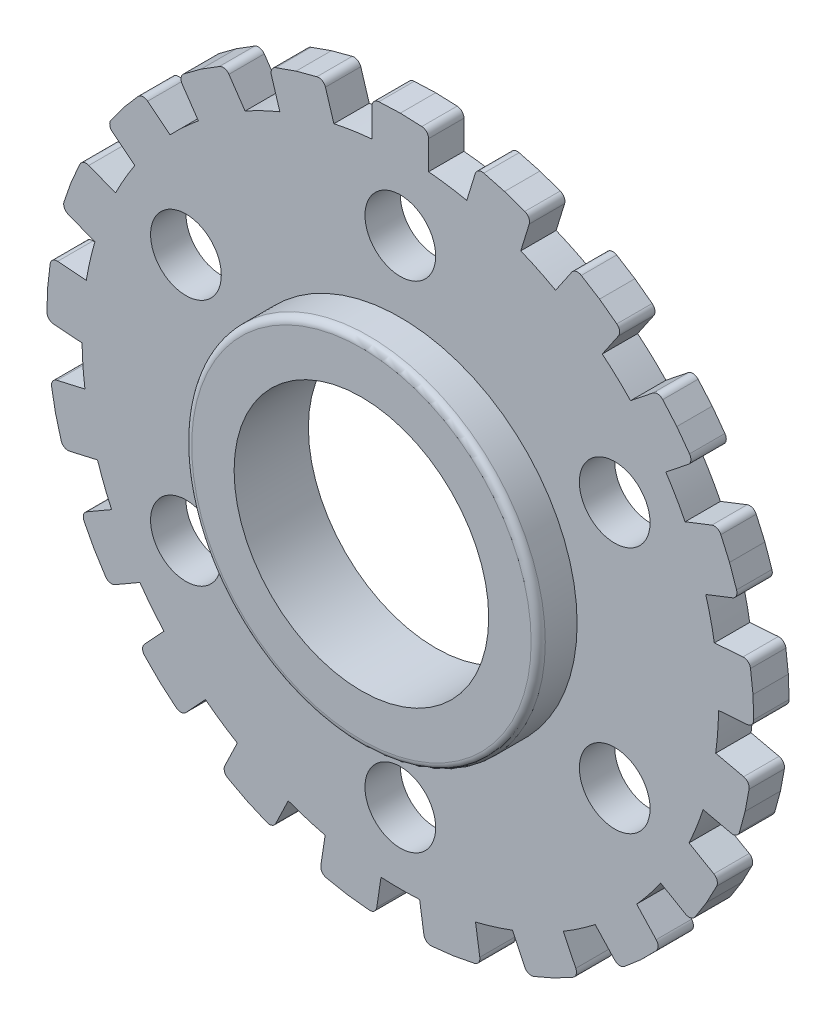
from build123d import *

# Parameters (mm, degrees)
SKETCH1_R               = 5
SKETCH1_R_2             = 18
BOSS_EXTRUDE4_DEPTH     = 2.5
SKETCH1_9_R             = 25
BOSS_EXTRUDE6_DEPTH     = 8
CUT_EXTRUDE5_DEPTH      = 72.13825771
CUT_EXTRUDE5_DEPTH_BACK = 72.13825771
SKETCH1_10_R            = 18
FILLET1_R               = 1


with BuildPart() as part:
    # Sketch1 → Boss-Extrude4 (new, symmetric)
    with BuildSketch(Plane.XY):
        with BuildLine():
            Line((3.036798719, 49.878430757), (0, 50))
            Line((0, 50), (-3.036798719, 49.878430757))
            ThreePointArc((-3.036798719, 49.878430757), (-3.717908974, 49.5720514), (-3.996798719, 48.879231077))
            Line((-3.996798719, 48.879231077), (-3.996798719, 44.822155236))
            ThreePointArc((-3.996798719, 44.822155236), (-6.706901978, 44.49738718), (-9.392330018, 44.008909744))
            Line((-9.392330018, 44.008909744), (-10.588174115, 47.885741089))
            ThreePointArc((-10.588174115, 47.885741089), (-11.058885946, 48.465577153), (-11.800043285, 48.557584163))
            Line((-11.800043285, 48.557584163), (-14.737758721, 47.778640289))
            Line((-14.737758721, 47.778640289), (-17.60380783, 46.767359891))
            ThreePointArc((-17.60380783, 46.767359891), (-18.164351366, 46.273831337), (-18.226638447, 45.529586882))
            Line((-18.226638447, 45.529586882), (-17.03079435, 41.652755537))
            ThreePointArc((-17.03079435, 41.652755537), (-19.52476826, 40.543599056), (-21.946909015, 39.285279491))
            Line((-21.946909015, 39.285279491), (-24.232341214, 42.637392861))
            ThreePointArc((-24.232341214, 42.637392861), (-24.853050319, 43.052723688), (-25.588399659, 42.922183124))
            Line((-25.588399659, 42.922183124), (-28.166002903, 41.311938716))
            Line((-28.166002903, 41.311938716), (-30.606641361, 39.500803863))
            ThreePointArc((-30.606641361, 39.500803863), (-30.996811427, 38.86397829), (-30.836961363, 38.134439088))
            Line((-30.836961363, 38.134439088), (-28.551529165, 34.782325718))
            ThreePointArc((-28.551529165, 34.782325718), (-30.6077732, 32.987334232), (-32.551408834, 31.070979755))
            Line((-32.551408834, 31.070979755), (-35.723358454, 33.600525167))
            ThreePointArc((-35.723358454, 33.600525167), (-36.438912106, 33.81444679), (-37.10311443, 33.472957754))
            Line((-37.10311443, 33.472957754), (-39.091574123, 31.174490093))
            Line((-39.091574123, 31.174490093), (-40.889940493, 28.724428065))
            ThreePointArc((-40.889940493, 28.724428065), (-41.075068765, 28.00089022), (-40.707284936, 27.350879032))
            Line((-40.707284936, 27.350879032), (-37.535335317, 24.821333619))
            ThreePointArc((-37.535335317, 24.821333619), (-38.97114317, 22.5), (-40.263573129, 20.095887114))
            Line((-40.263573129, 20.095887114), (-44.040198525, 21.578103358))
            ThreePointArc((-44.040198525, 21.578103358), (-44.787016642, 21.571607902), (-45.32105466, 21.049513194))
            Line((-45.32105466, 21.049513194), (-46.543687432, 18.267051218))
            Line((-46.543687432, 18.267051218), (-47.53998897, 15.395760779))
            ThreePointArc((-47.53998897, 15.395760779), (-47.503625988, 14.649800175), (-46.960587602, 14.137073346))
            Line((-46.960587602, 14.137073346), (-43.183962205, 12.654857102))
            ThreePointArc((-43.183962205, 12.654857102), (-43.871756048, 10.013442028), (-44.398142257, 7.335186715))
            Line((-44.398142257, 7.335186715), (-48.443873691, 7.638372372))
            ThreePointArc((-48.443873691, 7.638372372), (-49.155598205, 7.412036987), (-49.512020296, 6.755727012))
            Line((-49.512020296, 6.755727012), (-49.860189859, 3.736504679))
            Line((-49.860189859, 3.736504679), (-49.965900801, 0.699112585))
            ThreePointArc((-49.965900801, 0.699112585), (-49.711277576, -0.002988906), (-49.041235976, -0.332873346))
            Line((-49.041235976, -0.332873346), (-44.995504541, -0.636059004))
            ThreePointArc((-44.995504541, -0.636059004), (-44.874170873, -3.362854211), (-44.587741607, -6.077277215))
            Line((-44.587741607, -6.077277215), (-48.543098087, -6.98006152))
            ThreePointArc((-48.543098087, -6.98006152), (-49.156489151, -7.406125942), (-49.303625648, -8.138335162))
            Line((-49.303625648, -8.138335162), (-48.746395609, -11.126046698))
            Line((-48.746395609, -11.126046698), (-47.952123074, -14.059654831))
            ThreePointArc((-47.952123074, -14.059654831), (-47.501863997, -14.655512409), (-46.764355319, -14.773242781))
            Line((-46.764355319, -14.773242781), (-42.80899884, -13.870458476))
            ThreePointArc((-42.80899884, -13.870458476), (-41.889318689, -16.440346096), (-40.815524446, -18.949748394))
            Line((-40.815524446, -18.949748394), (-44.32905519, -20.978286314))
            ThreePointArc((-44.32905519, -20.978286314), (-44.789610317, -21.56622208), (-44.714387496, -22.309270542))
            Line((-44.714387496, -22.309270542), (-43.301270189, -25))
            Line((-43.301270189, -25), (-41.677588777, -27.569160215))
            ThreePointArc((-41.677588777, -27.569160215), (-41.071701343, -28.005829321), (-40.332256471, -27.900944763))
            Line((-40.332256471, -27.900944763), (-36.818725727, -25.872406842))
            ThreePointArc((-36.818725727, -25.872406842), (-35.182416711, -28.057041084), (-33.416668822, -30.138451268))
            Line((-33.416668822, -30.138451268), (-36.176181204, -33.112498308))
            ThreePointArc((-36.176181204, -33.112498308), (-36.44297805, -33.810064744), (-36.152079789, -34.497929332))
            Line((-36.152079789, -34.497929332), (-34.008636889, -36.652593591))
            Line((-34.008636889, -36.652593591), (-31.699817818, -38.629024729))
            ThreePointArc((-31.699817818, -38.629024729), (-30.992137785, -38.867705395), (-30.31645964, -38.549525362))
            Line((-30.31645964, -38.549525362), (-27.556947257, -35.575478322))
            ThreePointArc((-27.556947257, -35.575478322), (-25.349402613, -37.180744844), (-23.048595526, -38.649220487))
            Line((-23.048595526, -38.649220487), (-24.808894762, -42.304519515))
            ThreePointArc((-24.808894762, -42.304519515), (-24.858227257, -43.049734782), (-24.377501142, -43.621295709))
            Line((-24.377501142, -43.621295709), (-21.694186956, -45.048443395))
            Line((-21.694186956, -45.048443395), (-18.905378934, -46.256530875))
            ThreePointArc((-18.905378934, -46.256530875), (-18.158786778, -46.276015277), (-17.606912328, -45.77281146))
            Line((-17.606912328, -45.77281146), (-15.846613092, -42.117512433))
            ThreePointArc((-15.846613092, -42.117512433), (-13.263982848, -43.00077626), (-10.632553371, -43.725836857))
            Line((-10.632553371, -43.725836857), (-11.237229148, -47.737598513))
            ThreePointArc((-11.237229148, -47.737598513), (-11.064713882, -48.464246965), (-10.43687454, -48.868718533))
            Line((-10.43687454, -48.868718533), (-7.452113309, -49.441541311))
            Line((-7.452113309, -49.441541311), (-4.431114167, -49.773941259))
            ThreePointArc((-4.431114167, -49.773941259), (-3.711947877, -49.572498123), (-3.332913589, -48.92898239))
            Line((-3.332913589, -48.92898239), (-2.728237812, -44.917220734))
            ThreePointArc((-2.728237812, -44.917220734), (0, -45), (2.728237812, -44.917220734))
            Line((2.728237812, -44.917220734), (3.332913589, -48.92898239))
            ThreePointArc((3.332913589, -48.92898239), (3.711947877, -49.572498123), (4.431114167, -49.773941259))
            Line((4.431114167, -49.773941259), (7.452113309, -49.441541311))
            Line((7.452113309, -49.441541311), (10.43687454, -48.868718533))
            ThreePointArc((10.43687454, -48.868718533), (11.064713882, -48.464246965), (11.237229148, -47.737598513))
            Line((11.237229148, -47.737598513), (10.632553371, -43.725836857))
            ThreePointArc((10.632553371, -43.725836857), (13.263982848, -43.00077626), (15.846613092, -42.117512433))
            Line((15.846613092, -42.117512433), (17.606912328, -45.77281146))
            ThreePointArc((17.606912328, -45.77281146), (18.158786778, -46.276015277), (18.905378934, -46.256530875))
            Line((18.905378934, -46.256530875), (21.694186956, -45.048443395))
            Line((21.694186956, -45.048443395), (24.377501142, -43.621295709))
            ThreePointArc((24.377501142, -43.621295709), (24.858227257, -43.049734782), (24.808894762, -42.304519515))
            Line((24.808894762, -42.304519515), (23.048595526, -38.649220487))
            ThreePointArc((23.048595526, -38.649220487), (25.349402613, -37.180744844), (27.556947257, -35.575478322))
            Line((27.556947257, -35.575478322), (30.31645964, -38.549525362))
            ThreePointArc((30.31645964, -38.549525362), (30.992137785, -38.867705395), (31.699817818, -38.629024729))
            Line((31.699817818, -38.629024729), (34.008636889, -36.652593591))
            Line((34.008636889, -36.652593591), (36.152079789, -34.497929332))
            ThreePointArc((36.152079789, -34.497929332), (36.44297805, -33.810064744), (36.176181204, -33.112498308))
            Line((36.176181204, -33.112498308), (33.416668822, -30.138451268))
            ThreePointArc((33.416668822, -30.138451268), (35.182416711, -28.057041084), (36.818725727, -25.872406842))
            Line((36.818725727, -25.872406842), (40.332256471, -27.900944763))
            ThreePointArc((40.332256471, -27.900944763), (41.071701343, -28.005829321), (41.677588777, -27.569160215))
            Line((41.677588777, -27.569160215), (43.301270189, -25))
            Line((43.301270189, -25), (44.714387496, -22.309270542))
            ThreePointArc((44.714387496, -22.309270542), (44.789610317, -21.56622208), (44.32905519, -20.978286314))
            Line((44.32905519, -20.978286314), (40.815524446, -18.949748394))
            ThreePointArc((40.815524446, -18.949748394), (41.889318689, -16.440346096), (42.80899884, -13.870458475))
            Line((42.80899884, -13.870458475), (46.764355319, -14.773242781))
            ThreePointArc((46.764355319, -14.773242781), (47.501863997, -14.655512409), (47.952123074, -14.059654831))
            Line((47.952123074, -14.059654831), (48.746395609, -11.126046698))
            Line((48.746395609, -11.126046698), (49.303625648, -8.138335162))
            ThreePointArc((49.303625648, -8.138335162), (49.156489151, -7.406125942), (48.543098087, -6.98006152))
            Line((48.543098087, -6.98006152), (44.587741607, -6.077277215))
            ThreePointArc((44.587741607, -6.077277215), (44.874170873, -3.362854211), (44.995504542, -0.636059004))
            Line((44.995504542, -0.636059004), (49.041235976, -0.332873346))
            ThreePointArc((49.041235976, -0.332873346), (49.711277576, -0.002988906), (49.965900801, 0.699112585))
            Line((49.965900801, 0.699112585), (49.860189859, 3.736504679))
            Line((49.860189859, 3.736504679), (49.512020296, 6.755727012))
            ThreePointArc((49.512020296, 6.755727012), (49.155598205, 7.412036987), (48.443873691, 7.638372372))
            Line((48.443873691, 7.638372372), (44.398142257, 7.335186715))
            ThreePointArc((44.398142257, 7.335186715), (43.871756048, 10.013442028), (43.183962205, 12.654857102))
            Line((43.183962205, 12.654857102), (46.960587602, 14.137073346))
            ThreePointArc((46.960587602, 14.137073346), (47.503625988, 14.649800175), (47.53998897, 15.395760779))
            Line((47.53998897, 15.395760779), (46.543687432, 18.267051218))
            Line((46.543687432, 18.267051218), (45.32105466, 21.049513194))
            ThreePointArc((45.32105466, 21.049513194), (44.787016642, 21.571607902), (44.040198525, 21.578103358))
            Line((44.040198525, 21.578103358), (40.263573129, 20.095887114))
            ThreePointArc((40.263573129, 20.095887114), (38.97114317, 22.5), (37.535335317, 24.821333619))
            Line((37.535335317, 24.821333619), (40.707284936, 27.350879032))
            ThreePointArc((40.707284936, 27.350879032), (41.075068765, 28.00089022), (40.889940493, 28.724428065))
            Line((40.889940493, 28.724428065), (39.091574123, 31.174490093))
            Line((39.091574123, 31.174490093), (37.10311443, 33.472957754))
            ThreePointArc((37.10311443, 33.472957754), (36.438912106, 33.81444679), (35.723358454, 33.600525167))
            Line((35.723358454, 33.600525167), (32.551408834, 31.070979755))
            ThreePointArc((32.551408834, 31.070979755), (30.6077732, 32.987334232), (28.551529165, 34.782325718))
            Line((28.551529165, 34.782325718), (30.836961363, 38.134439088))
            ThreePointArc((30.836961363, 38.134439088), (30.996811427, 38.86397829), (30.606641361, 39.500803863))
            Line((30.606641361, 39.500803863), (28.166002903, 41.311938716))
            Line((28.166002903, 41.311938716), (25.588399659, 42.922183124))
            ThreePointArc((25.588399659, 42.922183124), (24.853050319, 43.052723688), (24.232341214, 42.637392861))
            Line((24.232341214, 42.637392861), (21.946909015, 39.285279491))
            ThreePointArc((21.946909015, 39.285279491), (19.52476826, 40.543599056), (17.03079435, 41.652755537))
            Line((17.03079435, 41.652755537), (18.226638447, 45.529586882))
            ThreePointArc((18.226638447, 45.529586882), (18.164351366, 46.273831337), (17.60380783, 46.767359891))
            Line((17.60380783, 46.767359891), (14.737758721, 47.778640289))
            Line((14.737758721, 47.778640289), (11.800043285, 48.557584163))
            ThreePointArc((11.800043285, 48.557584163), (11.058885946, 48.465577153), (10.588174115, 47.885741089))
            Line((10.588174115, 47.885741089), (9.392330018, 44.008909744))
            ThreePointArc((9.392330018, 44.008909744), (6.706901978, 44.49738718), (3.996798719, 44.822155236))
            Line((3.996798719, 44.822155236), (3.996798719, 48.879231077))
            ThreePointArc((3.996798719, 48.879231077), (3.717908974, 49.5720514), (3.036798719, 49.878430757))
        make_face()
        with Locations((0, -35)):
            Circle(SKETCH1_R, mode=Mode.SUBTRACT)
        with Locations((-30.310889132, -17.5)):
            Circle(SKETCH1_R, mode=Mode.SUBTRACT)
        with Locations((30.310889132, -17.5)):
            Circle(SKETCH1_R, mode=Mode.SUBTRACT)
        with Locations((-30.310889132, 17.5)):
            Circle(SKETCH1_R, mode=Mode.SUBTRACT)
        with Locations((0, 35)):
            Circle(SKETCH1_R, mode=Mode.SUBTRACT)
        with Locations((30.310889132, 17.5)):
            Circle(SKETCH1_R, mode=Mode.SUBTRACT)
        Circle(SKETCH1_R_2, mode=Mode.SUBTRACT)
    extrude(amount=BOSS_EXTRUDE4_DEPTH, both=True)

    # Sketch1<9> → Boss-Extrude6 (add)
    with BuildSketch(Plane.XY):
        Circle(SKETCH1_9_R)
    extrude(amount=BOSS_EXTRUDE6_DEPTH)

    # Sketch1<10> → Cut-Extrude5 (cut, two sides: drawn at the far end of the back side and taken through both)
    with BuildSketch(Plane.XY.offset(-CUT_EXTRUDE5_DEPTH_BACK)):
        Circle(SKETCH1_10_R)
    extrude(amount=CUT_EXTRUDE5_DEPTH + CUT_EXTRUDE5_DEPTH_BACK, mode=Mode.SUBTRACT)

    # Fillet1
    fillet1_edges = [part.edges().sort_by_distance(p)[0] for p in [
        (-25, 0, 8),
    ]]
    fillet(fillet1_edges, radius=FILLET1_R)


solid = part.part
